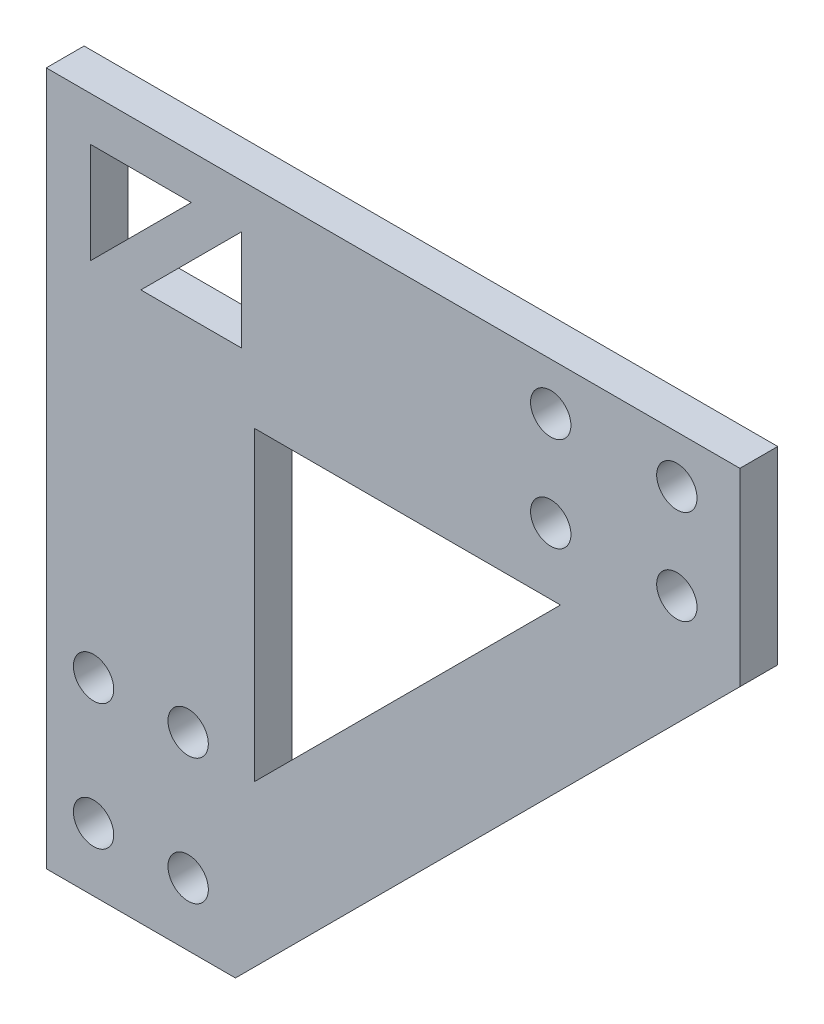
from build123d import *

# Parameters (mm, degrees)
SKETCH_1_R      = 1.6
EXTRUDE_1_DEPTH = 3


with BuildPart() as part:
    # 草图1 → 凸台-拉伸1 (new body)
    with BuildSketch(Plane.XY):
        Polygon((0, 0), (55, 0), (55, -15), (15, -55), (0, -55), align=None)
        with Locations((3.75, -50)):
            Circle(SKETCH_1_R, mode=Mode.SUBTRACT)
        with Locations(Location((11.25, -50, 0), (0, 0, 180))):
            Circle(SKETCH_1_R, mode=Mode.SUBTRACT)
        with Locations((11.25, -40)):
            Circle(SKETCH_1_R, mode=Mode.SUBTRACT)
        with Locations(Location((3.75, -40, 0), (0, 0, 180))):
            Circle(SKETCH_1_R, mode=Mode.SUBTRACT)
        with Locations((50, -3.75)):
            Circle(SKETCH_1_R, mode=Mode.SUBTRACT)
        with Locations(Location((50, -11.25, 0), (0, 0, 180))):
            Circle(SKETCH_1_R, mode=Mode.SUBTRACT)
        with Locations((40, -11.25)):
            Circle(SKETCH_1_R, mode=Mode.SUBTRACT)
        with Locations(Location((40, -3.75, 0), (0, 0, 180))):
            Circle(SKETCH_1_R, mode=Mode.SUBTRACT)
        Polygon((16.5, -16.5), (16.5, -40.772077939), (40.772077939, -16.5), align=None, mode=Mode.SUBTRACT)
        Polygon((3.5, -3.5), (11.5, -3.5), (3.5, -11.5), align=None, mode=Mode.SUBTRACT)
        Polygon((15.5, -3.5), (7.5, -11.5), (15.5, -11.5), align=None, mode=Mode.SUBTRACT)
    extrude(amount=EXTRUDE_1_DEPTH)


solid = part.part
